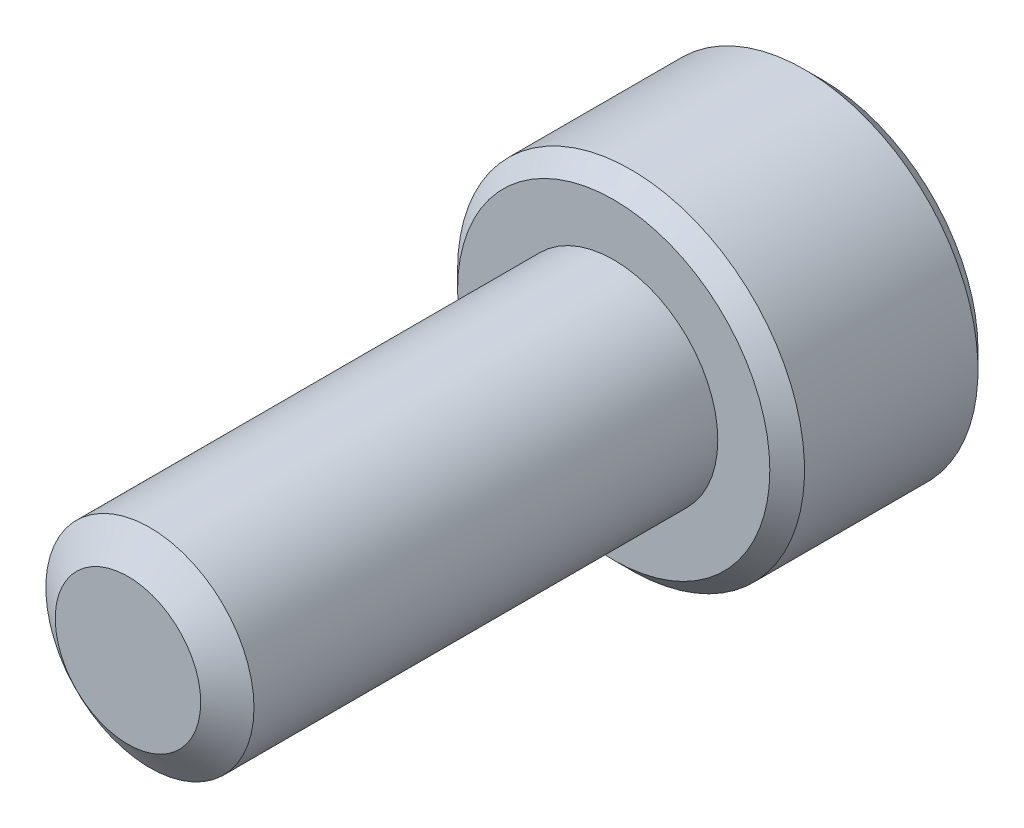
from build123d import *

# Parameters (mm, degrees)
SKETCH1_R          = 3
EXTRUDE1_DEPTH     = 14
SKETCH6_R          = 5
EXTRUDE2_DEPTH     = 6
CUT_EXTRUDE1_DEPTH = 3.75
CHAMFER1_SIZE      = 0.5


with BuildPart() as part:
    # Sketch1 → Extrude1 (new body)
    with BuildSketch(Plane.XY):
        Circle(SKETCH1_R)
    extrude(amount=-EXTRUDE1_DEPTH)

    # Sketch4 → Cut-Revolve1 (revolve, cut)
    with BuildSketch(Plane(origin=(0, 0, 0), x_dir=(0, 0, -1), z_dir=(1, 0, 0))):
        Polygon((0.632650852, 3), (0, 2.096480947), (0, 3), align=None)
    revolve(axis=Axis((0, 0, 0), (0, 0, -1)), mode=Mode.SUBTRACT)

    # Sketch6 → Extrude2 (add)
    with BuildSketch(Plane(origin=(0, 0, -14), x_dir=(-1, 0, 0), z_dir=(0, 0, -1))):
        Circle(SKETCH6_R)
    extrude(amount=EXTRUDE2_DEPTH)

    # Sketch7 → Cut-Extrude1 (cut)
    with BuildSketch(Plane(origin=(0, 0, -20), x_dir=(-1, 0, 0), z_dir=(0, 0, -1))):
        Polygon((0, 2.886751346), (-2.5, 1.443375673), (-2.5, -1.443375673), (0, -2.886751346), (2.5, -1.443375673), (2.5, 1.443375673), align=None)
    extrude(amount=-CUT_EXTRUDE1_DEPTH, mode=Mode.SUBTRACT)

    # Cut-Extrude2 cone 1 section (through the dimple's axis) → Cut-Extrude2 (revolve, cut)
    with BuildSketch(Plane(origin=(0, 0, -20), x_dir=(0, 1, 0), z_dir=(1, 0, 0))):
        Polygon((0, 0), (2.886751346, 0), (0, 2.886751346), align=None)
    revolve(axis=Axis((0, 0, -20), (0, 0, 1)), mode=Mode.SUBTRACT)

    # Chamfer1
    chamfer1_edges = [part.edges().sort_by_distance(p)[0] for p in [
        (5, 0, -20),
        (5, 0, -14),
    ]]
    chamfer(chamfer1_edges, length=CHAMFER1_SIZE)


solid = part.part
